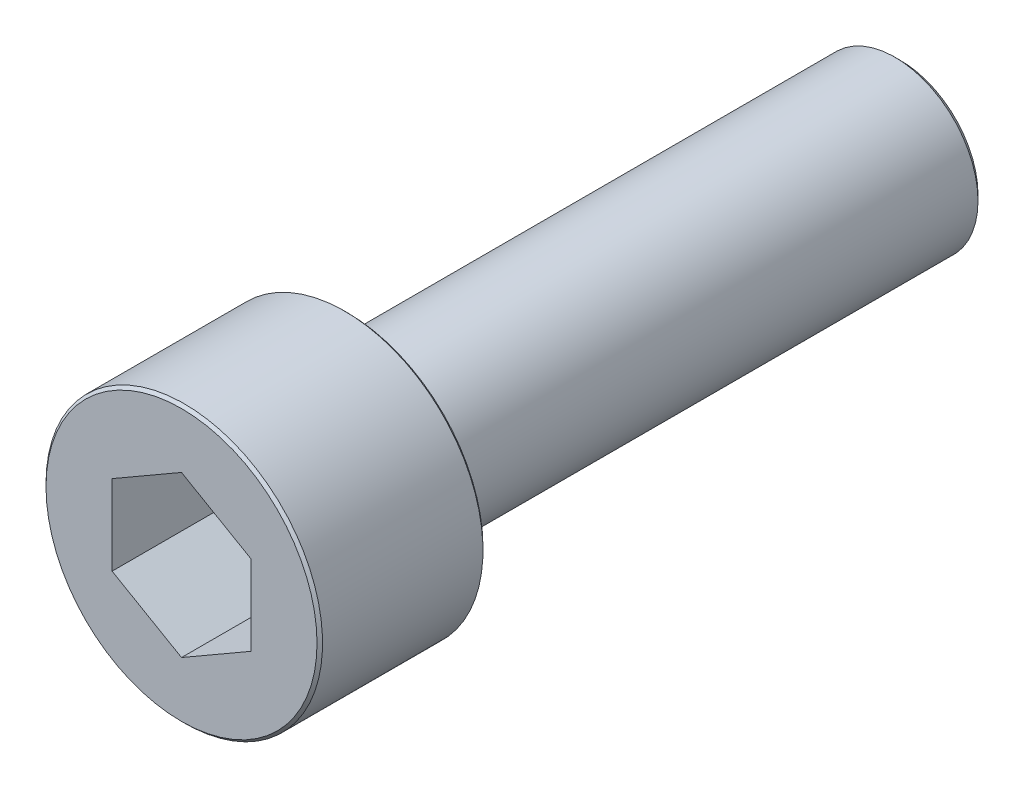
from build123d import *

# Parameters (mm, degrees)
SKETCH_1_W          = 5
SKETCH_1_H          = 6
SKETCH_2_R          = 3
EXTRUDE_1_DEPTH     = 20
CUT_EXTRUDE_1_DEPTH = 4.5
CHAMFER_1_SIZE2     = 0.099999645
CHAMFER_1_SIZE      = 0.099999691
CHAMFER_2_SIZE      = 0.200023114
CHAMFER_2_SIZE2     = 0.200024766


with BuildPart() as part:
    # 草图1 → 旋转1 (revolve)
    with BuildSketch(Plane(origin=(0, 0, 0), x_dir=(1, 0, 0), z_dir=(0, 1, 0))):
        with Locations((2.5, -23)):
            Rectangle(SKETCH_1_W, SKETCH_1_H)
    revolve(axis=Axis((0, 0, 20), (0, 0, 1)))

    # 草图2 → 凸台-拉伸1 (add)
    with BuildSketch(Plane(origin=(0, 0, 20), x_dir=(-1, 0, 0), z_dir=(0, 0, -1))):
        Circle(SKETCH_2_R)
    extrude(amount=EXTRUDE_1_DEPTH)

    # 草图3 → 切除-拉伸1 (cut)
    with BuildSketch(Plane.XY.offset(26)):
        Polygon((-2.51, -1.449149176), (0, -2.898298351), (2.51, -1.449149176), (2.51, 1.449149176), (0, 2.898298351), (-2.51, 1.449149176), align=None)
    extrude(amount=-CUT_EXTRUDE_1_DEPTH, mode=Mode.SUBTRACT)

    # 倒角1
    chamfer_1_edges = [part.edges().sort_by_distance(p)[0] for p in [
        (-5, 0, 26),
        (-5, 0, 20),
    ]]
    chamfer(chamfer_1_edges, length=CHAMFER_1_SIZE, length2=CHAMFER_1_SIZE2)

    # 倒角2
    chamfer_2_edges = [part.edges().sort_by_distance(p)[0] for p in [
        (3, 0, 0),
    ]]
    chamfer_2_side = [part.faces().sort_by_distance(p)[0] for p in [
        (3, 0, 10),
    ]]
    chamfer(chamfer_2_edges, length=CHAMFER_2_SIZE, length2=CHAMFER_2_SIZE2, reference=chamfer_2_side[0])


solid = part.part
